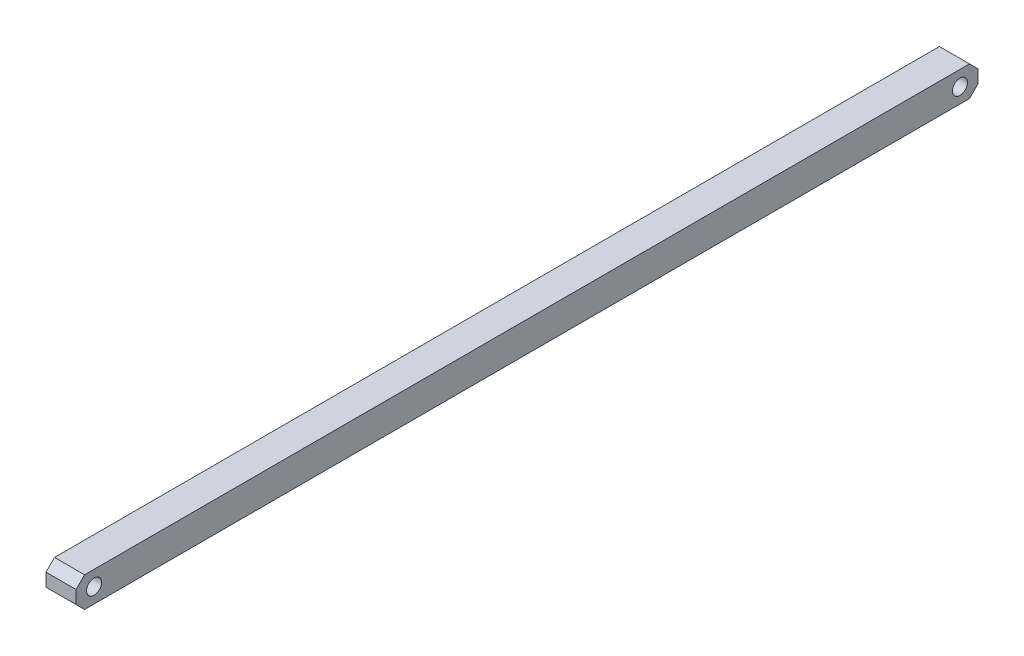
from build123d import *

# Parameters (mm, degrees)
SKETCH_1_W          = 10
SKETCH_1_H          = 10
EXTRUDE_1_DEPTH     = 300
SKETCH_2_R          = 2.5
CUT_EXTRUDE_1_DEPTH = 301.333148354


with BuildPart() as part:
    # ｽｹｯﾁ1 → ﾎﾞｽ - 押し出し1 (new body)
    with BuildSketch(Plane.XY):
        with Locations((5, -5)):
            Rectangle(SKETCH_1_W, SKETCH_1_H)
    extrude(amount=EXTRUDE_1_DEPTH)

    # ｽｹｯﾁ2 → ｶｯﾄ - 押し出し1 (cut, through all)
    with BuildSketch(Plane(origin=(10, 0, 0), x_dir=(0, 0, -1), z_dir=(1, 0, 0))):
        with Locations(Location((-6, -5, 0), (0, 0, 90))):
            Circle(SKETCH_2_R)
        with Locations(Location((-294, -5, 0), (0, 0, 270))):
            Circle(SKETCH_2_R)
        Polygon((-2.828427125, 0), (0, -2.828427125), (0, 0), align=None)
        Polygon((0, -7.171572875), (-2.828427125, -10), (0, -10), align=None)
        Polygon((-300, 0), (-297.171572875, 0), (-300, -2.828427125), align=None)
        Polygon((-300, -10), (-300, -7.171572875), (-297.171572875, -10), align=None)
    extrude(amount=-CUT_EXTRUDE_1_DEPTH, mode=Mode.SUBTRACT)


solid = part.part
